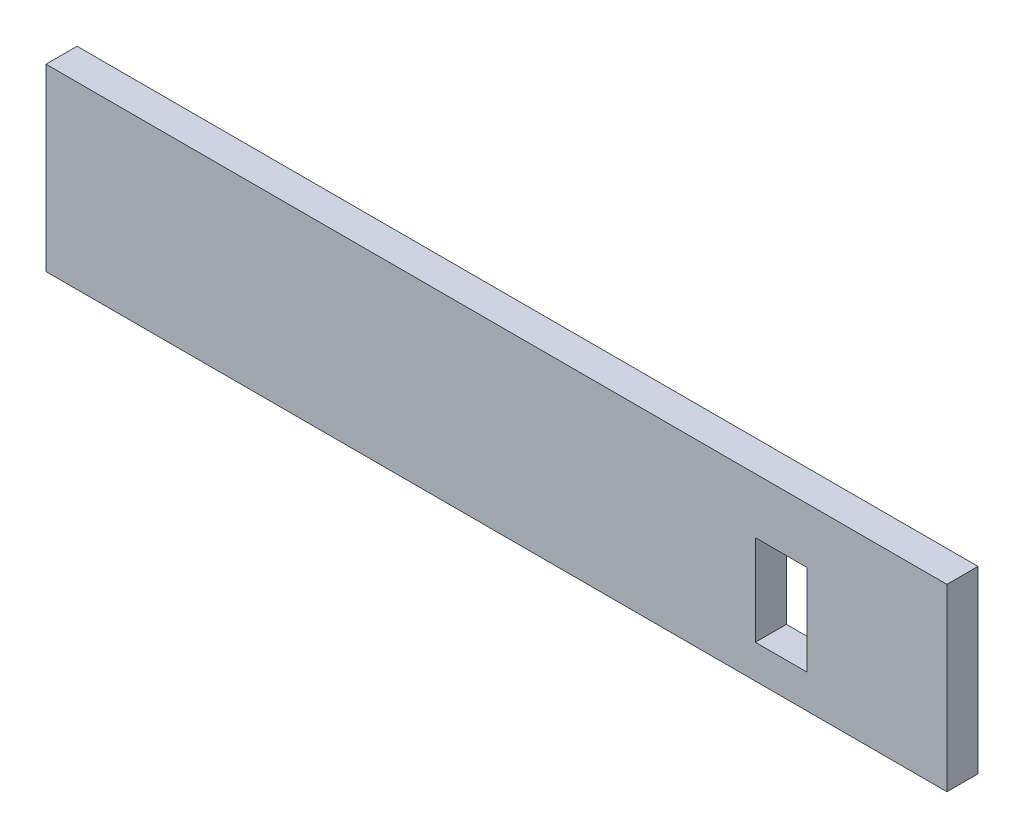
from build123d import *

# Parameters (mm, degrees)
SKETCH1_W           = 552.45
SKETCH1_H           = 110.14456
BOSS_EXTRUDE1_DEPTH = 19.05
SKETCH2_W           = 31.75
SKETCH2_H           = 55.5625
CUT_EXTRUDE1_DEPTH  = 283.304993136


with BuildPart() as part:
    # Sketch1 → Boss-Extrude1 (new body)
    with BuildSketch(Plane.XY):
        Rectangle(SKETCH1_W, SKETCH1_H)
    extrude(amount=BOSS_EXTRUDE1_DEPTH)

    # Sketch2 → Cut-Extrude1 (cut, through all)
    with BuildSketch(Plane(origin=(0, 0, 0), x_dir=(-1, 0, 0), z_dir=(0, 0, -1))):
        with Locations((-174.625, -6.65353)):
            Rectangle(SKETCH2_W, SKETCH2_H)
    extrude(amount=-CUT_EXTRUDE1_DEPTH, mode=Mode.SUBTRACT)


solid = part.part
